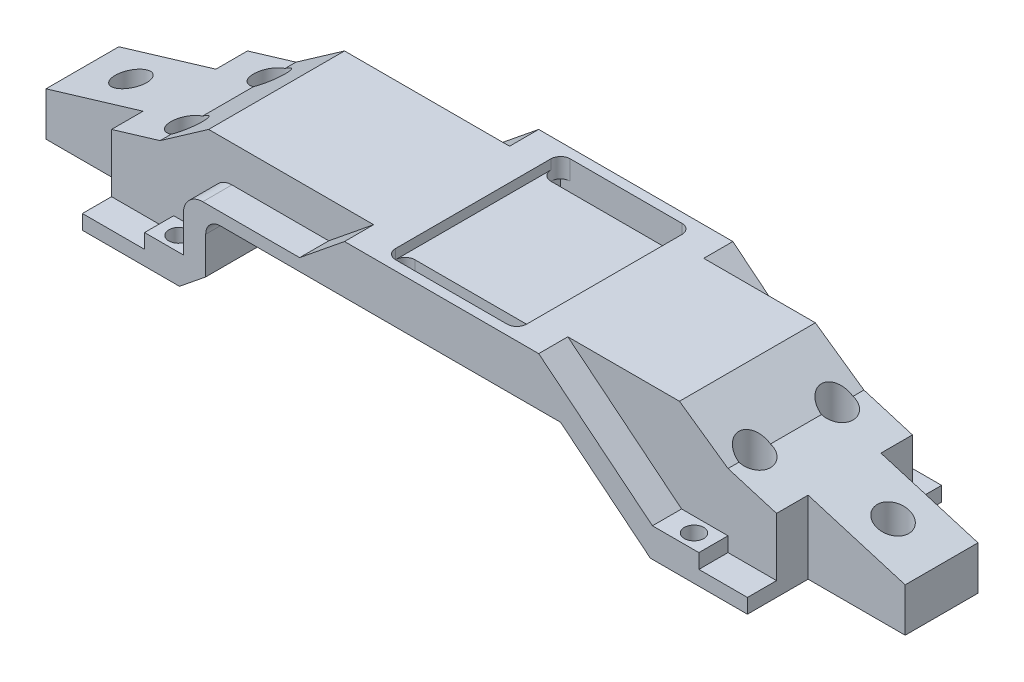
from build123d import *

# Parameters (mm, degrees)
SKETCH1_R           = 1.8
BOSS_EXTRUDE1_DEPTH = 6
BOSS_EXTRUDE2_DEPTH = 40
CUT_EXTRUDE1_REACH  = 94.7
SKETCH3_W           = 20
SKETCH3_H           = 12.5
SKETCH4_R           = 3.25
CUT_EXTRUDE2_DEPTH  = 19
CUT_EXTRUDE3_REACH  = 102.286
CUT_EXTRUDE4_START  = -7
CUT_EXTRUDE4_DEPTH  = 26
SKETCH7_W           = 27
SKETCH7_H           = 36
CUT_EXTRUDE5_DEPTH  = 6
CUT_EXTRUDE6_REACH  = 95.13
SKETCH9_W           = 27
SKETCH9_H           = 32
CUT_EXTRUDE7_DEPTH  = 2
CUT_EXTRUDE10_DEPTH = 101.285841473
FILLET1_R           = 3
CUT_EXTRUDE11_DEPTH = 6
SKETCH12_W          = 8
SKETCH12_H          = 6
SKETCH12_W_2        = 10
BOSS_EXTRUDE3_DEPTH = 3
SKETCH13_R          = 2
CUT_EXTRUDE12_DEPTH = 6


with BuildPart() as part:
    # Sketch1 → Boss-Extrude1 (new body)
    with BuildSketch(Plane(origin=(0, 0, 0), x_dir=(1, 0, 0), z_dir=(0, 1, 0))):
        Polygon((68.5, 20), (68.5, 7.5), (88.5, 7.5), (88.5, -7.5), (68.5, -7.5), (68.5, -20), (-68.5, -20), (-68.5, -7.5), (-88.5, -7.5), (-88.5, 7.5), (-68.5, 7.5), (-68.5, 20), align=None)
        with Locations(Location((-78.5, 0, 0), (0, 0, 270))):
            Circle(SKETCH1_R, mode=Mode.SUBTRACT)
        with Locations(Location((-58.5, 8.5, 0), (0, 0, 270))):
            Circle(SKETCH1_R, mode=Mode.SUBTRACT)
        with Locations(Location((-58.5, -8.5, 0), (0, 0, 270))):
            Circle(SKETCH1_R, mode=Mode.SUBTRACT)
        with Locations(Location((58.5, -8.5, 0), (0, 0, 90))):
            Circle(SKETCH1_R, mode=Mode.SUBTRACT)
        with Locations(Location((78.5, 0, 0), (0, 0, 90))):
            Circle(SKETCH1_R, mode=Mode.SUBTRACT)
        with Locations(Location((58.5, 8.5, 0), (0, 0, 90))):
            Circle(SKETCH1_R, mode=Mode.SUBTRACT)
    extrude(amount=BOSS_EXTRUDE1_DEPTH)

    # Sketch2 → Boss-Extrude2 (add)
    with BuildSketch(Plane(origin=(0, 0, -20), x_dir=(-1, 0, 0), z_dir=(0, 0, -1))):
        Polygon((-88.5, 6), (88.5, 6), (88.5, 9), (58.5, 18), (48.5, 25), (-48.5, 25), (-58.5, 18), (-88.5, 9), align=None)
    extrude(amount=-BOSS_EXTRUDE2_DEPTH)

    # Sketch3 → Cut-Extrude1 (cut, up to next)
    with BuildSketch(Plane.XZ.offset(-6), mode=Mode.PRIVATE) as cut_extrude1_sk1:
        with Locations((-78.5, 13.75)):
            Rectangle(SKETCH3_W, SKETCH3_H)
    cut_extrude1_tool1 = extrude(cut_extrude1_sk1.sketch, amount=-CUT_EXTRUDE1_REACH, mode=Mode.PRIVATE) & part.part
    # Sketch3 → Cut-Extrude1 (cut, up to next)
    with BuildSketch(Plane.XZ.offset(-6), mode=Mode.PRIVATE) as cut_extrude1_sk2:
        with Locations((-78.5, -13.75)):
            Rectangle(SKETCH3_W, SKETCH3_H)
    cut_extrude1_tool2 = extrude(cut_extrude1_sk2.sketch, amount=-CUT_EXTRUDE1_REACH, mode=Mode.PRIVATE) & part.part
    # Sketch3 → Cut-Extrude1 (cut, up to next)
    with BuildSketch(Plane.XZ.offset(-6), mode=Mode.PRIVATE) as cut_extrude1_sk3:
        with Locations((78.5, 13.75)):
            Rectangle(SKETCH3_W, SKETCH3_H)
    cut_extrude1_tool3 = extrude(cut_extrude1_sk3.sketch, amount=-CUT_EXTRUDE1_REACH, mode=Mode.PRIVATE) & part.part
    # Sketch3 → Cut-Extrude1 (cut, up to next)
    with BuildSketch(Plane.XZ.offset(-6), mode=Mode.PRIVATE) as cut_extrude1_sk4:
        with Locations((78.5, -13.75)):
            Rectangle(SKETCH3_W, SKETCH3_H)
    cut_extrude1_tool4 = extrude(cut_extrude1_sk4.sketch, amount=-CUT_EXTRUDE1_REACH, mode=Mode.PRIVATE) & part.part
    add(cut_extrude1_tool1.solids().sort_by_distance((-78.5, 6, 13.75))[0], mode=Mode.SUBTRACT)
    add(cut_extrude1_tool2.solids().sort_by_distance((-78.5, 6, -13.75))[0], mode=Mode.SUBTRACT)
    add(cut_extrude1_tool3.solids().sort_by_distance((78.5, 6, 13.75))[0], mode=Mode.SUBTRACT)
    add(cut_extrude1_tool4.solids().sort_by_distance((78.5, 6, -13.75))[0], mode=Mode.SUBTRACT)

    # Sketch4 → Cut-Extrude2 (cut)
    with BuildSketch(Plane(origin=(0, 25, 0), x_dir=(1, 0, 0), z_dir=(0, 1, 0))):
        with Locations(Location((-58.5, 8.5, 0), (0, 0, 90))):
            Circle(SKETCH4_R)
        with Locations(Location((-78.5, 0, 0), (0, 0, 90))):
            Circle(SKETCH4_R)
        with Locations(Location((-58.5, -8.5, 0), (0, 0, 90))):
            Circle(SKETCH4_R)
        with Locations(Location((58.5, 8.5, 0), (0, 0, 90))):
            Circle(SKETCH4_R)
        with Locations(Location((58.5, -8.5, 0), (0, 0, 90))):
            Circle(SKETCH4_R)
        with Locations(Location((78.5, 0, 0), (0, 0, 180))):
            Circle(SKETCH4_R)
    extrude(amount=-CUT_EXTRUDE2_DEPTH, mode=Mode.SUBTRACT)

    # Sketch5 → Cut-Extrude3 (cut, up to next)
    with BuildSketch(Plane(origin=(0, 0, -20), x_dir=(-1, 0, 0), z_dir=(0, 0, -1)), mode=Mode.PRIVATE) as cut_extrude3_sk1:
        Polygon((48.5, 0), (30, 15), (-30, 15), (-48.5, 0), align=None)
    cut_extrude3_tool1 = extrude(cut_extrude3_sk1.sketch, amount=-CUT_EXTRUDE3_REACH, mode=Mode.PRIVATE) & part.part
    add(cut_extrude3_tool1.solids().sort_by_distance((0, 6.910828, -20))[0], mode=Mode.SUBTRACT)

    # Sketch6 → Cut-Extrude4 (cut)
    with BuildSketch(Plane(origin=(0, 0, -20), x_dir=(-1, 0, 0), z_dir=(0, 0, -1)).offset(CUT_EXTRUDE4_START)):
        Polygon((43.1, 4.378378378), (43.1, 20.378378378), (-53.9, 20.378378378), (-53.9, 0), (-48.5, 0), (-30, 15), (30, 15), align=None)
    extrude(amount=-CUT_EXTRUDE4_DEPTH, mode=Mode.SUBTRACT)

    # Sketch7 → Cut-Extrude5 (cut)
    with BuildSketch(Plane(origin=(0, 15, 0), x_dir=(-1, 0, 0), z_dir=(0, -1, 0))):
        with Locations((-5.5, 0)):
            Rectangle(SKETCH7_W, SKETCH7_H)
    extrude(amount=-CUT_EXTRUDE5_DEPTH, mode=Mode.SUBTRACT)

    # Sketch8 → Cut-Extrude6 (cut, up to next)
    with BuildSketch(Plane.XZ.offset(-21), mode=Mode.PRIVATE) as cut_extrude6_sk1:
        with BuildLine():
            Line((17, -18), (-6, -18))
            ThreePointArc((-6, -18), (-8, -16), (-6, -14))
            Line((-6, -14), (17, -14))
            ThreePointArc((17, -14), (19, -16), (17, -18))
        make_face()
    cut_extrude6_tool1 = extrude(cut_extrude6_sk1.sketch, amount=-CUT_EXTRUDE6_REACH, mode=Mode.PRIVATE) & part.part
    # Sketch8 → Cut-Extrude6 (cut, up to next)
    with BuildSketch(Plane.XZ.offset(-21), mode=Mode.PRIVATE) as cut_extrude6_sk2:
        with BuildLine():
            Line((17, 14), (-6, 14))
            ThreePointArc((-6, 14), (-8, 16), (-6, 18))
            Line((-6, 18), (17, 18))
            ThreePointArc((17, 18), (19, 16), (17, 14))
        make_face()
    cut_extrude6_tool2 = extrude(cut_extrude6_sk2.sketch, amount=-CUT_EXTRUDE6_REACH, mode=Mode.PRIVATE) & part.part
    add(cut_extrude6_tool1.solids().sort_by_distance((5.5, 21, -16))[0], mode=Mode.SUBTRACT)
    add(cut_extrude6_tool2.solids().sort_by_distance((5.5, 21, 16))[0], mode=Mode.SUBTRACT)

    # Sketch9 → Cut-Extrude7 (cut)
    with BuildSketch(Plane(origin=(0, 25, 0), x_dir=(1, 0, 0), z_dir=(0, 1, 0))):
        with Locations((5.5, 0)):
            Rectangle(SKETCH9_W, SKETCH9_H)
    extrude(amount=-CUT_EXTRUDE7_DEPTH, mode=Mode.SUBTRACT)

    # Sketch10 → Cut-Extrude10 (cut, through all)
    with BuildSketch(Plane(origin=(0, 0, -20), x_dir=(-1, 0, 0), z_dir=(0, 0, -1))):
        Polygon((43.1, 4.378378378), (30, 15), (43.1, 15), align=None)
    extrude(amount=-CUT_EXTRUDE10_DEPTH, mode=Mode.SUBTRACT)

    # Fillet1
    fillet1_edges = [part.edges().sort_by_distance(p)[0] for p in [
        (-43.1, 15, -16.5),
        (-43.1, 15, 16.5),
    ]]
    fillet(fillet1_edges, radius=FILLET1_R)

    # Sketch11 → Cut-Extrude11 (cut)
    with BuildSketch(Plane.XY.offset(20)):
        Polygon((25.5, 25), (48.5, 25), (58.5, 18), (68.5, 15), (68.5, 3), (52.633333333, 3), align=None)
        with BuildLine():
            Line((-68.5, 3), (-47.7, 3))
            Line((-47.7, 3), (-47.7, 13.5))
            ThreePointArc((-47.7, 13.5), (-46.528427125, 16.328427125), (-43.7, 17.5))
            Line((-43.7, 17.5), (-23.75, 17.5))
            Line((-23.75, 17.5), (-14.5, 25))
            Line((-14.5, 25), (-48.5, 25))
            Line((-48.5, 25), (-58.5, 18))
            Line((-58.5, 18), (-68.5, 15))
            Line((-68.5, 15), (-68.5, 3))
        make_face()
    cut_extrude11 = extrude(amount=-CUT_EXTRUDE11_DEPTH, mode=Mode.SUBTRACT)

    # Mirror1: Cut-Extrude11 across plane
    add(cut_extrude11.mirror(Plane(origin=(0, 0, 0), x_dir=(1, 0, 0), z_dir=(0, 0, -1))), mode=Mode.SUBTRACT)

    # Sketch12 → Boss-Extrude3 (add)
    with BuildSketch(Plane(origin=(0, 3, 0), x_dir=(1, 0, 0), z_dir=(0, 1, 0))):
        with Locations((-51.7, 17)):
            Rectangle(SKETCH12_W, SKETCH12_H)
        with Locations((-51.7, -17)):
            Rectangle(SKETCH12_W, SKETCH12_H)
        with Locations((53.5, -17)):
            Rectangle(SKETCH12_W_2, SKETCH12_H)
        with Locations((53.5, 17)):
            Rectangle(SKETCH12_W_2, SKETCH12_H)
    extrude(amount=BOSS_EXTRUDE3_DEPTH)

    # Sketch13 → Cut-Extrude12 (cut)
    with BuildSketch(Plane(origin=(0, 6, 0), x_dir=(1, 0, 0), z_dir=(0, 1, 0))):
        with Locations(Location((54.5, -17, 0), (0, 0, 270))):
            Circle(SKETCH13_R)
        with Locations(Location((54.5, 17, 0), (0, 0, 270))):
            Circle(SKETCH13_R)
        with Locations(Location((-51.7, 17, 0), (0, 0, 270))):
            Circle(SKETCH13_R)
        with Locations(Location((-51.7, -17, 0), (0, 0, 270))):
            Circle(SKETCH13_R)
    extrude(amount=-CUT_EXTRUDE12_DEPTH, mode=Mode.SUBTRACT)


solid = part.part
